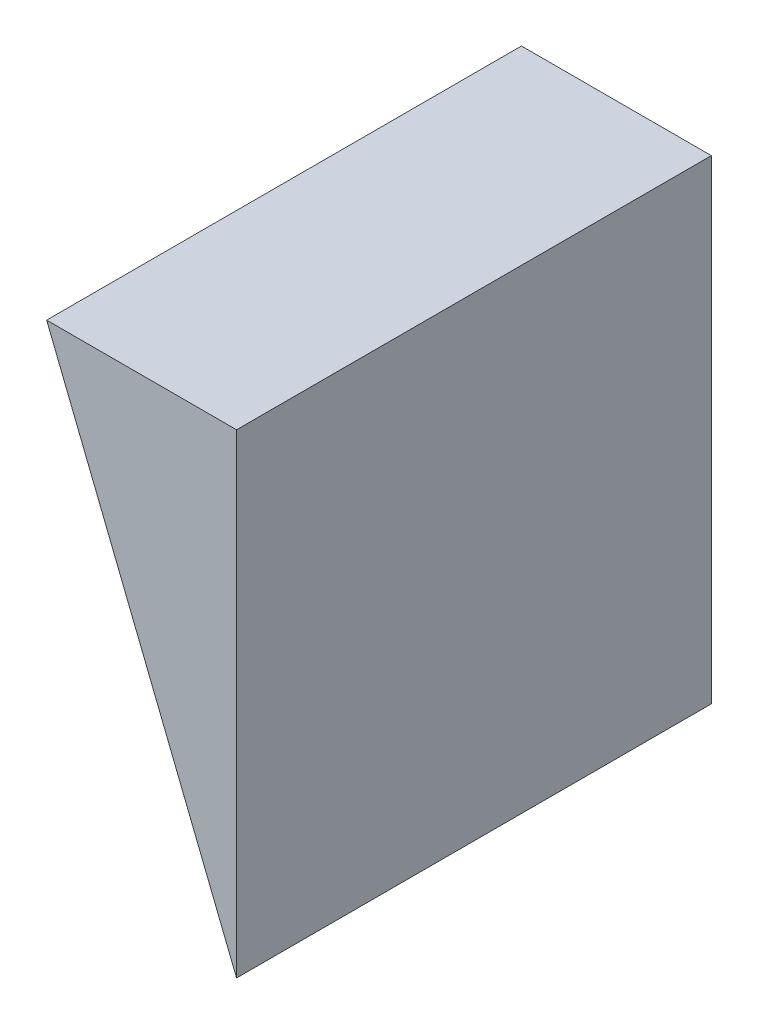
from build123d import *

# Parameters (mm, degrees)
BOSS_EXTRUDE1_DEPTH = 5


with BuildPart() as part:
    # Sketch1 → Boss-Extrude1 (new body)
    with BuildSketch(Plane.XY):
        Polygon((0, 0), (0, -5), (-2, 0), align=None)
    extrude(amount=BOSS_EXTRUDE1_DEPTH)


solid = part.part
